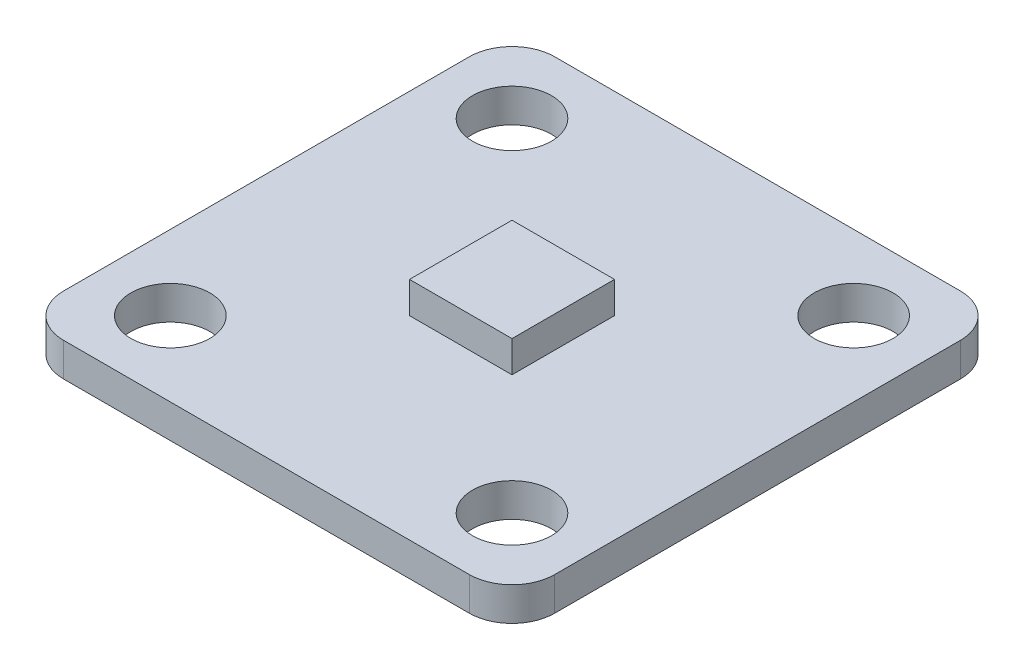
from build123d import *

# Parameters (mm, degrees)
SKETCH1_R           = 1.85
SKETCH1_W           = 4.8
SKETCH1_H           = 4.8
BOSS_EXTRUDE1_DEPTH = 1.57
SKETCH2_W           = 4.8
SKETCH2_H           = 4.8
BOSS_EXTRUDE2_DEPTH = 1.47


with BuildPart() as part:
    # Sketch1 → Boss-Extrude1 (new body)
    # profile 1 of 2: a face of its own
    with BuildSketch(Plane(origin=(0, 0, 0), x_dir=(1, 0, 0), z_dir=(0, 1, 0))):
        with BuildLine():
            ThreePointArc((-11.5, 9.5), (-10.914213562, 10.914213562), (-9.5, 11.5))
            Line((-9.5, 11.5), (9.5, 11.5))
            ThreePointArc((9.5, 11.5), (10.914213562, 10.914213562), (11.5, 9.5))
            Line((11.5, 9.5), (11.5, -9.5))
            ThreePointArc((11.5, -9.5), (10.914213562, -10.914213562), (9.5, -11.5))
            Line((9.5, -11.5), (-9.5, -11.5))
            ThreePointArc((-9.5, -11.5), (-10.914213562, -10.914213562), (-11.5, -9.5))
            Line((-11.5, -9.5), (-11.5, 9.5))
        make_face()
        with Locations(Location((-8, -8, 0), (0, 0, 270))):
            Circle(SKETCH1_R, mode=Mode.SUBTRACT)
        with Locations(Location((8, -8, 0), (0, 0, 270))):
            Circle(SKETCH1_R, mode=Mode.SUBTRACT)
        with Locations(Location((8, 8, 0), (0, 0, 270))):
            Circle(SKETCH1_R, mode=Mode.SUBTRACT)
        with Locations(Location((-8, 8, 0), (0, 0, 270))):
            Circle(SKETCH1_R, mode=Mode.SUBTRACT)
        Rectangle(SKETCH1_W, SKETCH1_H, mode=Mode.SUBTRACT)
    # profile 2 of 2: a face of its own
    with BuildSketch(Plane(origin=(0, 0, 0), x_dir=(1, 0, 0), z_dir=(0, 1, 0))):
        Rectangle(SKETCH1_W, SKETCH1_H)
    extrude(amount=BOSS_EXTRUDE1_DEPTH)

    # Sketch2 → Boss-Extrude2 (add)
    with BuildSketch(Plane(origin=(0, 1.57, 0), x_dir=(1, 0, 0), z_dir=(0, 1, 0))):
        Rectangle(SKETCH2_W, SKETCH2_H)
    extrude(amount=BOSS_EXTRUDE2_DEPTH)


solid = part.part
